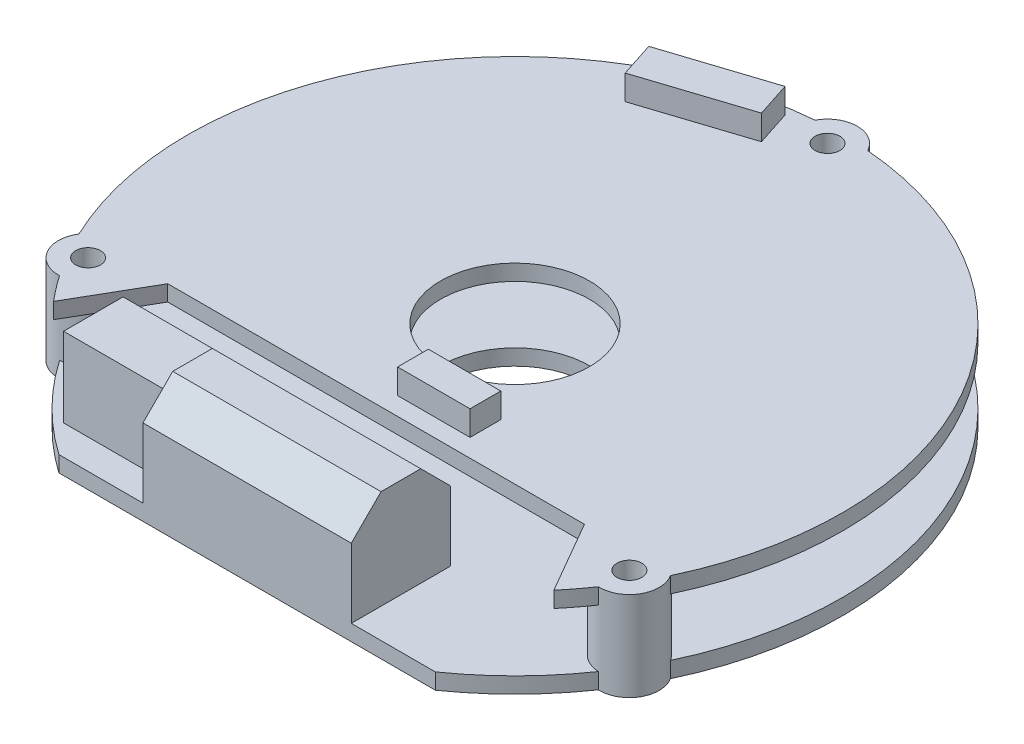
from build123d import *
from build123d.topology import SkipClean

# Parameters (mm, degrees)
SKETCH_1_R          = 7.5
EXTRUDE_1_DEPTH     = 1.6
SKETCH_4_R          = 3
EXTRUDE_2_DEPTH     = 5.8
SKETCH_6_R          = 7.5
EXTRUDE_3_DEPTH     = 1.6
SKETCH_7_W          = 21
SKETCH_7_H          = 10
EXTRUDE_4_DEPTH     = 10
CHAMFER_1_SIZE      = 3
SKETCH_8_W          = 10
SKETCH_8_H          = 6
EXTRUDE_5_DEPTH     = 8
SKETCH_9_W          = 7.3
SKETCH_9_H          = 3.1
EXTRUDE_6_DEPTH     = 2.5
EXTRUDE_7_DEPTH     = 2.5
CUT_EXTRUDE_3_REACH = 50.582
SKETCH_11_R         = 1.25
CUT_EXTRUDE_4_REACH = 50.778


with BuildPart() as part:
    # 草图1 → 凸台-拉伸1 (new body)
    with BuildSketch(Plane(origin=(0, 0, 0), x_dir=(1, 0, 0), z_dir=(0, 1, 0))):
        with BuildLine():
            ThreePointArc((-2.65705645, 32.892857143), (-28.578838325, 16.5), (-29.814578114, -14.145350186))
            ThreePointArc((-29.814578114, -14.145350186), (-29.877876431, -17.25), (-27.157521664, -18.747506957))
            ThreePointArc((-27.157521664, -18.747506957), (0, -33), (27.157521664, -18.747506957))
            ThreePointArc((27.157521664, -18.747506957), (29.877876431, -17.25), (29.814578114, -14.145350186))
            ThreePointArc((29.814578114, -14.145350186), (28.578838325, 16.5), (2.65705645, 32.892857143))
            ThreePointArc((2.65705645, 32.892857143), (0, 34.5), (-2.65705645, 32.892857143))
        make_face()
        with Locations(Location((0, 0, 0), (0, 0, 270))):
            Circle(SKETCH_1_R, mode=Mode.SUBTRACT)
    extrude(amount=EXTRUDE_1_DEPTH)

    # 草图4 → 凸台-拉伸2 (add)
    with BuildSketch(Plane(origin=(0, 1.6, 0), x_dir=(1, 0, 0), z_dir=(0, 1, 0))):
        with Locations(Location((0, 31.5, 0), (0, 0, 27.664004496))):
            Circle(SKETCH_4_R)
        with Locations(Location((27.279800219, -15.75, 0), (0, 0, 32.335995504))):
            Circle(SKETCH_4_R)
        with Locations(Location((-27.279800219, -15.75, 0), (0, 0, 147.664004496))):
            Circle(SKETCH_4_R)
    extrude(amount=EXTRUDE_2_DEPTH)

    # 草图6 → 凸台-拉伸3 (add)
    with SkipClean():  # the faces are left unmerged after this step: merging them gives an invalid solid
        with BuildSketch(Plane(origin=(0, 7.4, 0), x_dir=(1, 0, 0), z_dir=(0, 1, 0))):
            with BuildLine():
                Line((-21, -14), (21, -14))
                Line((21, -14), (25.210881382, -21.293460498))
                ThreePointArc((25.210881382, -21.293460498), (26.215126916, -20.044129334), (27.157521664, -18.747506957))
                ThreePointArc((27.157521664, -18.747506957), (29.877876431, -17.25), (29.814578114, -14.145350186))
                ThreePointArc((29.814578114, -14.145350186), (28.578838325, 16.5), (2.65705645, 32.892857143))
                ThreePointArc((2.65705645, 32.892857143), (0, 34.5), (-2.65705645, 32.892857143))
                ThreePointArc((-2.65705645, 32.892857143), (-28.578838325, 16.5), (-29.814578114, -14.145350186))
                ThreePointArc((-29.814578114, -14.145350186), (-29.877876431, -17.25), (-27.157521664, -18.747506957))
                ThreePointArc((-27.157521664, -18.747506957), (-26.215126916, -20.044129334), (-25.210881382, -21.293460498))
                Line((-25.210881382, -21.293460498), (-21, -14))
            make_face()
            with Locations(Location((0, 0, 0), (0, 0, 270))):
                Circle(SKETCH_6_R, mode=Mode.SUBTRACT)
        extrude(amount=EXTRUDE_3_DEPTH)

    # 草图7 → 凸台-拉伸4 (add)
    with SkipClean():  # the faces are left unmerged after this step: merging them gives an invalid solid
        with BuildSketch(Plane(origin=(0, 1.6, 0), x_dir=(1, 0, 0), z_dir=(0, 1, 0))):
            with Locations((0, -22)):
                Rectangle(SKETCH_7_W, SKETCH_7_H)
        extrude(amount=EXTRUDE_4_DEPTH)

    # 倒角1
    chamfer_1_edges = [part.edges().sort_by_distance(p)[0] for p in [
        (0, 11.6, 17),
        (0, 11.6, 27),
    ]]
    chamfer(chamfer_1_edges, length=CHAMFER_1_SIZE)

    # 草图8 → 凸台-拉伸5 (add)
    with SkipClean():  # the faces are left unmerged after this step: merging them gives an invalid solid
        with BuildSketch(Plane(origin=(0, 1.6, 0), x_dir=(1, 0, 0), z_dir=(0, 1, 0))):
            with Locations((-16.5, -21)):
                Rectangle(SKETCH_8_W, SKETCH_8_H)
        extrude(amount=EXTRUDE_5_DEPTH)

    # 草图9 → 凸台-拉伸6 (add)
    with SkipClean():  # the faces are left unmerged after this step: merging them gives an invalid solid
        with BuildSketch(Plane(origin=(0, 9, 0), x_dir=(1, 0, 0), z_dir=(0, 1, 0))):
            with Locations((4, -10.632060859)):
                Rectangle(SKETCH_9_W, SKETCH_9_H)
        extrude(amount=EXTRUDE_6_DEPTH)

    # 草图10 → 凸台-拉伸7 (add)
    with SkipClean():  # the faces are left unmerged after this step: merging them gives an invalid solid
        with BuildSketch(Plane(origin=(0, 9, 0), x_dir=(1, 0, 0), z_dir=(0, 1, 0))):
            Polygon((-13.835733856, 24.945439837), (-3.469217829, 28.313725076), (-4.612580708, 31.832634186), (-14.979096735, 28.464348947), align=None)
        extrude(amount=EXTRUDE_7_DEPTH)

    # 草图11 → 切除-拉伸3 (cut, up to next)
    with BuildSketch(Plane(origin=(0, 9, 0), x_dir=(1, 0, 0), z_dir=(0, 1, 0)), mode=Mode.PRIVATE) as cut_extrude_3_sk1:
        with Locations(Location((0, 31.5, 0), (0, 0, 270))):
            Circle(SKETCH_11_R)
    cut_extrude_3_tool1 = extrude(cut_extrude_3_sk1.sketch, amount=-CUT_EXTRUDE_3_REACH, mode=Mode.PRIVATE) & part.part
    # 草图11 → 切除-拉伸3 (cut, up to next)
    with BuildSketch(Plane(origin=(0, 9, 0), x_dir=(1, 0, 0), z_dir=(0, 1, 0)), mode=Mode.PRIVATE) as cut_extrude_3_sk2:
        with Locations(Location((27.279800219, -15.75, 0), (0, 0, 270))):
            Circle(SKETCH_11_R)
    cut_extrude_3_tool2 = extrude(cut_extrude_3_sk2.sketch, amount=-CUT_EXTRUDE_3_REACH, mode=Mode.PRIVATE) & part.part
    # 草图11 → 切除-拉伸3 (cut, up to next)
    with BuildSketch(Plane(origin=(0, 9, 0), x_dir=(1, 0, 0), z_dir=(0, 1, 0)), mode=Mode.PRIVATE) as cut_extrude_3_sk3:
        with Locations(Location((-27.279800219, -15.75, 0), (0, 0, 270))):
            Circle(SKETCH_11_R)
    cut_extrude_3_tool3 = extrude(cut_extrude_3_sk3.sketch, amount=-CUT_EXTRUDE_3_REACH, mode=Mode.PRIVATE) & part.part
    add(cut_extrude_3_tool1.solids().sort_by_distance((0, 9, -31.5))[0], mode=Mode.SUBTRACT)
    add(cut_extrude_3_tool2.solids().sort_by_distance((27.2798, 9, 15.75))[0], mode=Mode.SUBTRACT)
    add(cut_extrude_3_tool3.solids().sort_by_distance((-27.2798, 9, 15.75))[0], mode=Mode.SUBTRACT)

    # 草图12 → 切除-拉伸4 (cut, up to next)
    with BuildSketch(Plane(origin=(0, 1.6, 0), x_dir=(1, 0, 0), z_dir=(0, 1, 0)), mode=Mode.PRIVATE) as cut_extrude_4_sk1:
        with BuildLine():
            Line((18.973665961, -27), (-18.973665961, -27))
            ThreePointArc((-18.973665961, -27), (0, -33), (18.973665961, -27))
        make_face()
    cut_extrude_4_tool1 = extrude(cut_extrude_4_sk1.sketch, amount=-CUT_EXTRUDE_4_REACH, mode=Mode.PRIVATE) & part.part
    add(cut_extrude_4_tool1.solids().sort_by_distance((0, 1.6, 29.419743))[0], mode=Mode.SUBTRACT)


solid = part.part
